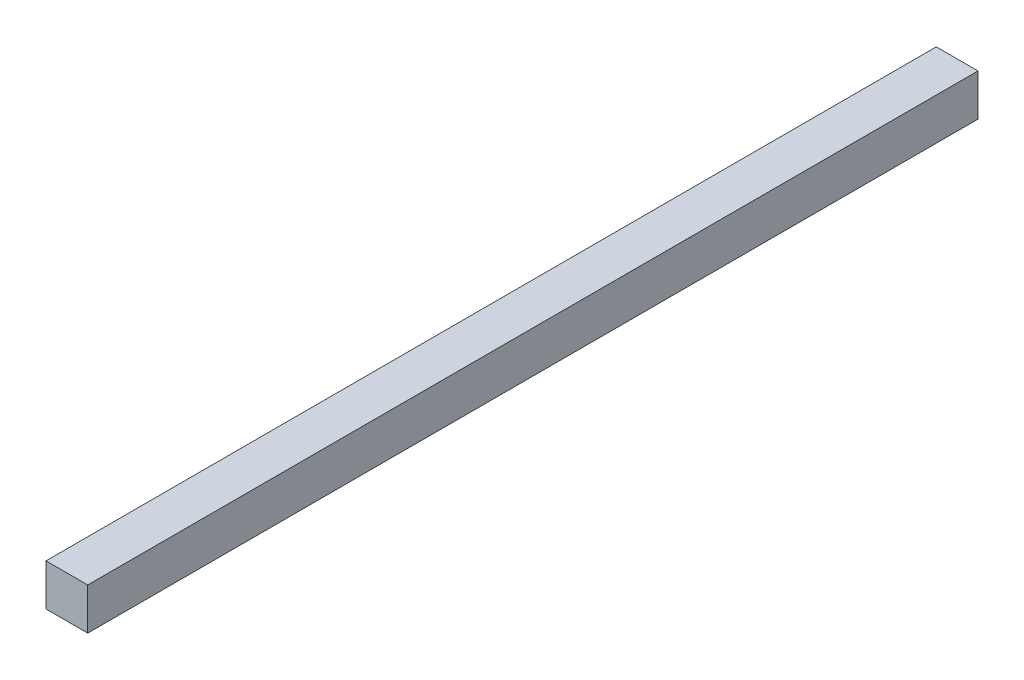
from build123d import *

# Parameters (mm, degrees)
SKETCH1_W           = 38.1
SKETCH1_H           = 38.1
BOSS_EXTRUDE1_DEPTH = 812.8


with BuildPart() as part:
    # Sketch1 → Boss-Extrude1 (new body)
    with BuildSketch(Plane.XY):
        with Locations((0, 692.15)):
            Rectangle(SKETCH1_W, SKETCH1_H)
    extrude(amount=BOSS_EXTRUDE1_DEPTH)


solid = part.part
